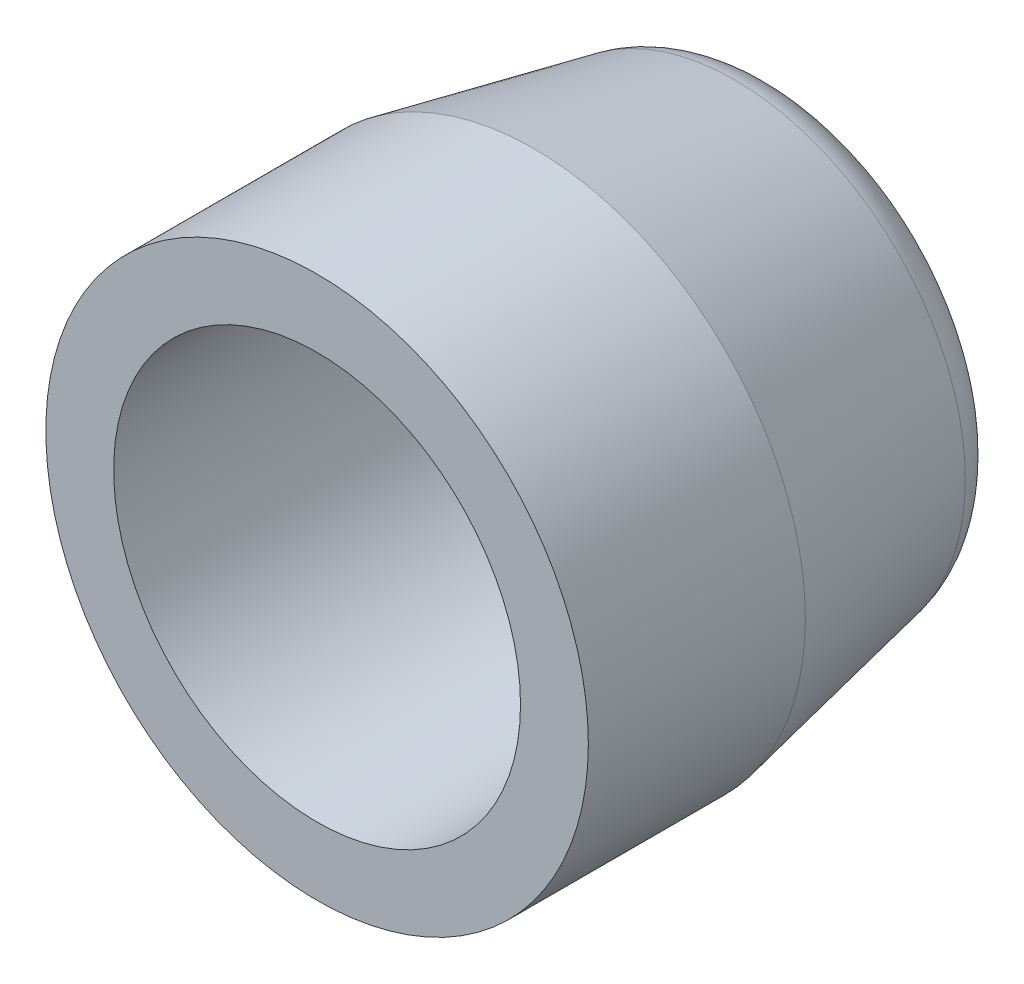
from build123d import *


with BuildPart() as part:
    # Эскиз1 → Повернуть1 (revolve)
    with BuildSketch(Plane(origin=(0, 0, 0), x_dir=(1, 0, 0), z_dir=(0, 1, 0))):
        with BuildLine():
            Line((5, 0), (5, 4))
            Line((5, 4), (4.25, 7.698728048))
            ThreePointArc((4.25, 7.698728048), (3.902903442, 8.27418604), (3.269945327, 8.5))
            Line((3.269945327, 8.5), (1.5, 8.5))
            Line((1.5, 8.5), (1.5, 7.1))
            Line((1.5, 7.1), (3.75, 7.1))
            Line((3.75, 7.1), (3.75, 0))
            Line((3.75, 0), (5, 0))
        make_face()
    revolve(axis=Axis((0, 0, 0), (0, 0, -1)))


solid = part.part
